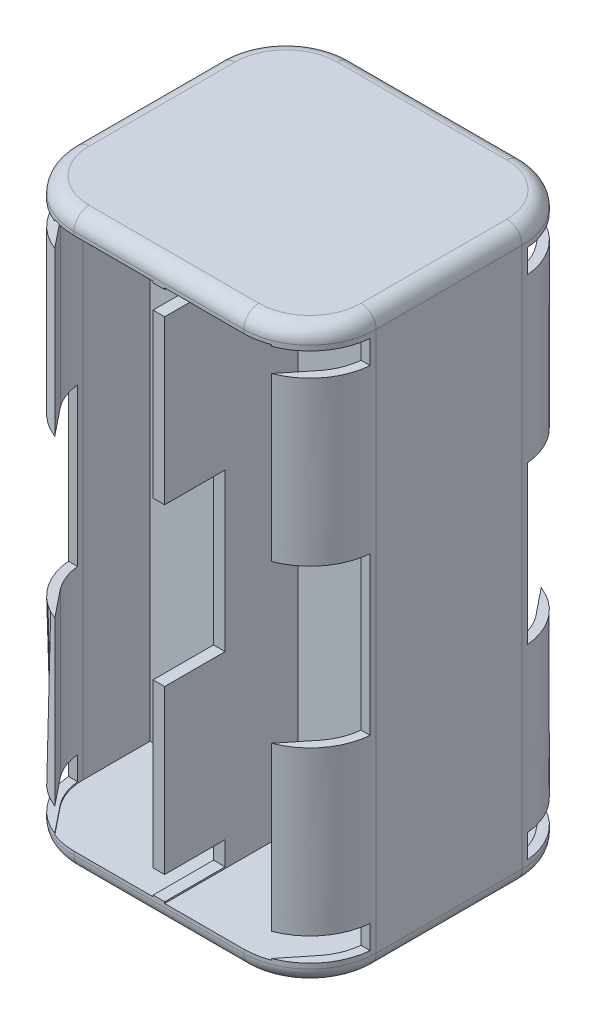
from build123d import *

# Parameters (mm, degrees)
BOSS_EXTRUDE1_DEPTH     = 28.315
FILLET1_R               = 1.5
CUT_EXTRUDE2_DEPTH      = 26.465
CUT_EXTRUDE2_DEPTH_BACK = 26.465
CUT_EXTRUDE3_DEPTH      = 35.892052501
CUT_EXTRUDE3_DEPTH_BACK = 35.892052501
SKETCH7_W               = 8.863459335
SKETCH7_H               = 15.62219905
SKETCH7_H_2             = 2.337495039
SCALE1_SCALE            = 0.3478


with BuildPart() as part:
    # Sketch1 → Boss-Extrude1 (new, symmetric)
    with BuildSketch(Plane(origin=(0, 0, 0), x_dir=(1, 0, 0), z_dir=(0, 1, 0))):
        with BuildLine():
            Line((-8.425, 13.81), (8.425, 13.81))
            ThreePointArc((8.425, 13.81), (13.074227086, 11.884227086), (15, 7.235))
            Line((15, 7.235), (15, -7.235))
            ThreePointArc((15, -7.235), (13.074227086, -11.884227086), (8.425, -13.81))
            Line((8.425, -13.81), (-8.425, -13.81))
            ThreePointArc((-8.425, -13.81), (-13.074227086, -11.884227086), (-15, -7.235))
            Line((-15, -7.235), (-15, 7.235))
            ThreePointArc((-15, 7.235), (-13.074227086, 11.884227086), (-8.425, 13.81))
        make_face()
    extrude(amount=BOSS_EXTRUDE1_DEPTH, both=True)

    # Fillet1
    fillet1_edges = [part.edges().sort_by_distance(p)[0] for p in [
        (0, -28.315, 13.81),
        (-13.074227086, -28.315, 11.884227086),
        (-15, -28.315, 0),
        (-13.074227086, -28.315, -11.884227086),
        (-13.074227086, 28.315, 11.884227086),
        (0, 28.315, 13.81),
        (13.074227086, 28.315, 11.884227086),
        (15, 28.315, 0),
        (13.074227086, 28.315, -11.884227086),
        (0, 28.315, -13.81),
        (-13.074227086, 28.315, -11.884227086),
        (0, -28.315, -13.81),
        (-15, 28.315, 0),
        (13.074227086, -28.315, -11.884227086),
        (15, -28.315, 0),
        (13.074227086, -28.315, 11.884227086),
    ]]
    fillet(fillet1_edges, radius=FILLET1_R)

    # Sketch6 → Cut-Extrude2 (cut, two sides: drawn at the far end of the back side and taken through both)
    with BuildSketch(Plane(origin=(0, 0, 0), x_dir=(1, 0, 0), z_dir=(0, 1, 0)).offset(-CUT_EXTRUDE2_DEPTH_BACK)):
        with BuildLine():
            Line((-0.575, -0.575), (-14.1, -0.575))
            Line((-14.1, -0.575), (-14.1, -7.235))
            ThreePointArc((-14.1, -7.235), (-13.817993139, -9.001705974), (-13, -10.592826678))
            Line((-13, -10.592826678), (-8.866634788, -15.748593929))
            Line((-8.866634788, -15.748593929), (-0.575, -15.748593929))
            Line((-0.575, -15.748593929), (-0.575, -7.235))
            Line((-0.575, -7.235), (-0.575, -0.575))
        make_face()
        with BuildLine():
            Line((14.1, -0.575), (14.1, -7.235))
            ThreePointArc((14.1, -7.235), (13.817993139, -9.001705974), (13, -10.592826678))
            Line((13, -10.592826678), (8.866634788, -15.748593929))
            Line((8.866634788, -15.748593929), (0.575, -15.748593929))
            Line((0.575, -15.748593929), (0.575, -7.235))
            Line((0.575, -7.235), (0.575, -0.575))
            Line((0.575, -0.575), (14.1, -0.575))
        make_face()
        with BuildLine():
            Line((0.575, 0.575), (0.575, 7.235))
            Line((0.575, 7.235), (0.575, 15.748593929))
            Line((0.575, 15.748593929), (8.866634788, 15.748593929))
            Line((8.866634788, 15.748593929), (13, 10.592826678))
            ThreePointArc((13, 10.592826678), (13.817993139, 9.001705974), (14.1, 7.235))
            Line((14.1, 7.235), (14.1, 0.575))
            Line((14.1, 0.575), (0.575, 0.575))
        make_face()
        with BuildLine():
            Line((-14.1, 0.575), (-14.1, 7.235))
            ThreePointArc((-14.1, 7.235), (-13.817993139, 9.001705974), (-13, 10.592826678))
            Line((-13, 10.592826678), (-8.866634788, 15.748593929))
            Line((-8.866634788, 15.748593929), (-0.575, 15.748593929))
            Line((-0.575, 15.748593929), (-0.575, 7.235))
            Line((-0.575, 7.235), (-0.575, 0.575))
            Line((-0.575, 0.575), (-14.1, 0.575))
        make_face()
    extrude(amount=CUT_EXTRUDE2_DEPTH + CUT_EXTRUDE2_DEPTH_BACK, mode=Mode.SUBTRACT)

    # Sketch7 → Cut-Extrude3 (cut, two sides: drawn at the far end of the back side and taken through both)
    with BuildSketch(Plane(origin=(0, 0, 0), x_dir=(0, 0, -1), z_dir=(1, 0, 0)).offset(-CUT_EXTRUDE3_DEPTH_BACK)):
        with Locations((-12.241729667, 0)):
            Rectangle(SKETCH7_W, SKETCH7_H)
        with Locations((12.241729667, 0)):
            Rectangle(SKETCH7_W, SKETCH7_H)
        with Locations((-12.241729667, -25.146252481)):
            Rectangle(SKETCH7_W, SKETCH7_H_2)
        with Locations((-12.241729667, 25.146252481)):
            Rectangle(SKETCH7_W, SKETCH7_H_2)
        with Locations((12.241729667, 25.146252481)):
            Rectangle(SKETCH7_W, SKETCH7_H_2)
        with Locations((12.241729667, -25.146252481)):
            Rectangle(SKETCH7_W, SKETCH7_H_2)
    extrude(amount=CUT_EXTRUDE3_DEPTH + CUT_EXTRUDE3_DEPTH_BACK, mode=Mode.SUBTRACT)


with BuildPart() as part_1:
    # Scale1: scaled about (0, 0, 0)
    add(part.part.scale(SCALE1_SCALE))


solid = part_1.part
